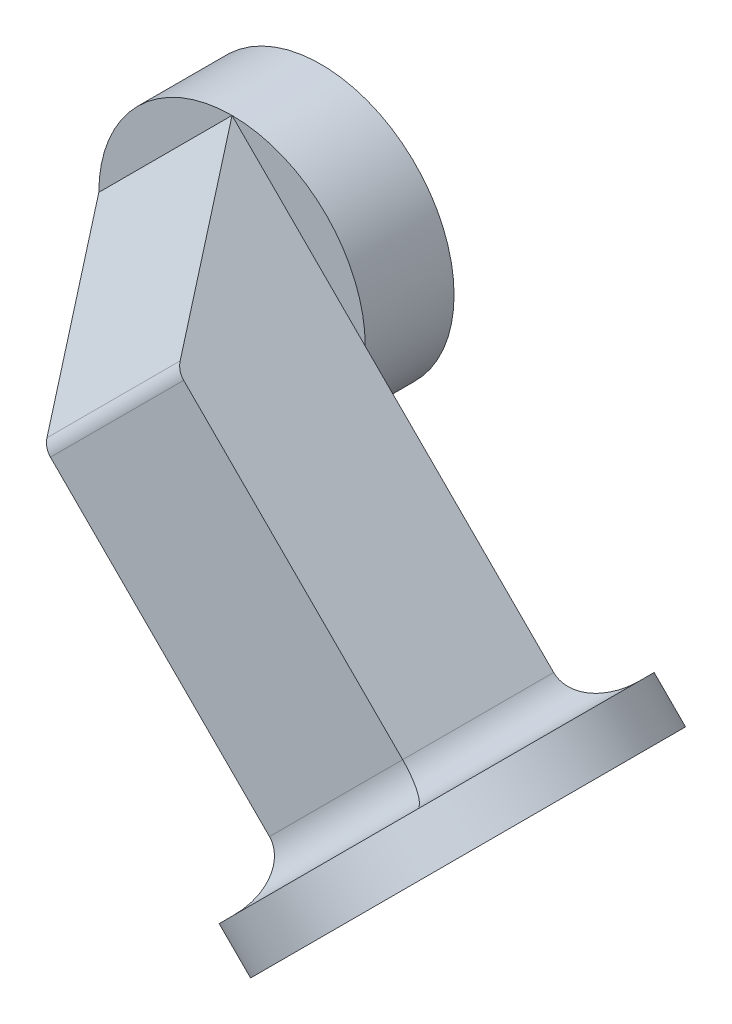
from build123d import *

# Parameters (mm, degrees)
SKETCH1_R           = 19.05
BOSS_EXTRUDE1_DEPTH = 12.7
BOSS_EXTRUDE2_DEPTH = 21.59
SKETCH4_W           = 21.59
SKETCH4_H           = 26.940768364
BOSS_EXTRUDE3_DEPTH = 43.18
CUT_EXTRUDE1_DEPTH  = 43.18
FILLET2_R           = 2.54
SKETCH6_R           = 25.4
BOSS_EXTRUDE4_DEPTH = 6.35
FILLET5_R           = 5.08
SKETCH7_R           = 4.064
CUT_EXTRUDE2_DEPTH  = 2.032


with BuildPart() as part:
    # Sketch1 → Boss-Extrude1 (new body)
    with BuildSketch(Plane.XY):
        Circle(SKETCH1_R)
    extrude(amount=BOSS_EXTRUDE1_DEPTH)

    # Sketch2 → Boss-Extrude2 (add)
    with BuildSketch(Plane.XY.offset(12.7)):
        Polygon((-19.05, 0), (0, -19.05), (19.05, 0), (0, 19.05), align=None)
    extrude(amount=BOSS_EXTRUDE2_DEPTH)

    # Sketch4 → Boss-Extrude3 (add)
    with BuildSketch(Plane(origin=(9.525, -9.525, 0), x_dir=(0, 0, -1), z_dir=(0.7071067811865477, -0.7071067811865475, 0))):
        with Locations((-23.495, 0)):
            Rectangle(SKETCH4_W, SKETCH4_H)
    extrude(amount=BOSS_EXTRUDE3_DEPTH)

    # Sketch5 → Cut-Extrude1 (cut)
    with BuildSketch(Plane(origin=(9.525, 9.525, 0), x_dir=(0, 0, -1), z_dir=(0.7071067811865475, 0.7071067811865476, 0))):
        Polygon((-34.29, -6.155864654), (-12.7, 13.470384182), (-34.29, 13.470384182), align=None)
    extrude(amount=-CUT_EXTRUDE1_DEPTH, mode=Mode.SUBTRACT)

    # Fillet2
    fillet2_edges = [part.edges().sort_by_distance(p)[0] for p in [
        (4.352853641, -4.352853641, 34.29),
    ]]
    fillet(fillet2_edges, radius=FILLET2_R)

    # Sketch6 → Boss-Extrude4 (add)
    with BuildSketch(Plane(origin=(40.057870812, -40.057870812, 0), x_dir=(0, 0, -1), z_dir=(0.7071067811865477, -0.7071067811865475, 0))):
        with Locations(Location((-23.495, 0, 0), (0, 0, 270))):
            Circle(SKETCH6_R)
    extrude(amount=BOSS_EXTRUDE4_DEPTH)

    # Fillet5
    fillet5_edges = [part.edges().sort_by_distance(p)[0] for p in [
        (40.057870812, -40.057870812, 34.29),
        (30.532870812, -49.582870812, 23.495),
        (40.057870812, -40.057870812, 12.7),
        (49.582870812, -30.532870812, 23.495),
    ]]
    fillet(fillet5_edges, radius=FILLET5_R)

    # Sketch7 → Cut-Extrude2 (cut)
    with BuildSketch(Plane(origin=(0, 0, 0), x_dir=(-1, 0, 0), z_dir=(0, 0, -1))):
        Circle(SKETCH7_R)
    extrude(amount=-CUT_EXTRUDE2_DEPTH, mode=Mode.SUBTRACT)


solid = part.part
